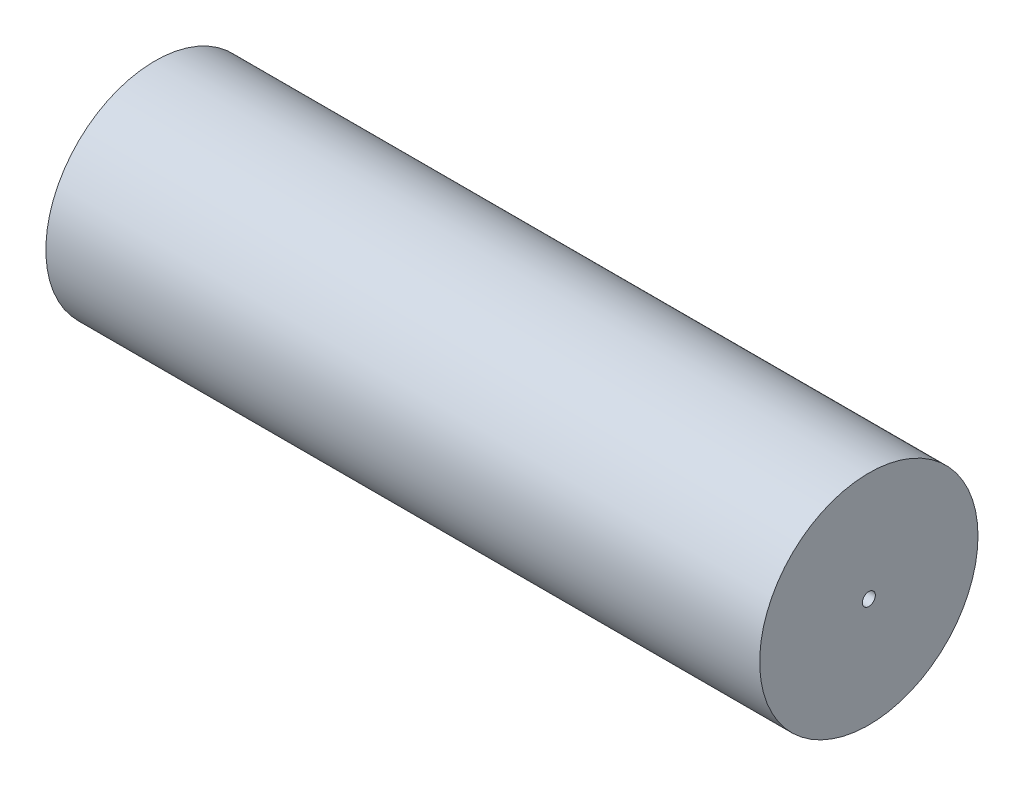
from build123d import *

# Parameters (mm, degrees)
SKETCH1_R           = 26
BOSS_EXTRUDE1_DEPTH = 170
SKETCH2_R           = 1.55
CUT_EXTRUDE1_DEPTH  = 5
SKETCH3_R           = 1.5
CUT_EXTRUDE2_DEPTH  = 5


with BuildPart() as part:
    # Sketch1 → Boss-Extrude1 (new body)
    with BuildSketch(Plane(origin=(0, 0, 0), x_dir=(0, 0, -1), z_dir=(1, 0, 0))):
        Circle(SKETCH1_R)
    extrude(amount=BOSS_EXTRUDE1_DEPTH)

    # Sketch2 → Cut-Extrude1 (cut)
    with BuildSketch(Plane(origin=(170, 0, 0), x_dir=(0, 0, -1), z_dir=(1, 0, 0))):
        Circle(SKETCH2_R)
    extrude(amount=-CUT_EXTRUDE1_DEPTH, mode=Mode.SUBTRACT)

    # Sketch3 → Cut-Extrude2 (cut)
    with BuildSketch(Plane.ZY):
        Circle(SKETCH3_R)
    extrude(amount=-CUT_EXTRUDE2_DEPTH, mode=Mode.SUBTRACT)


solid = part.part
